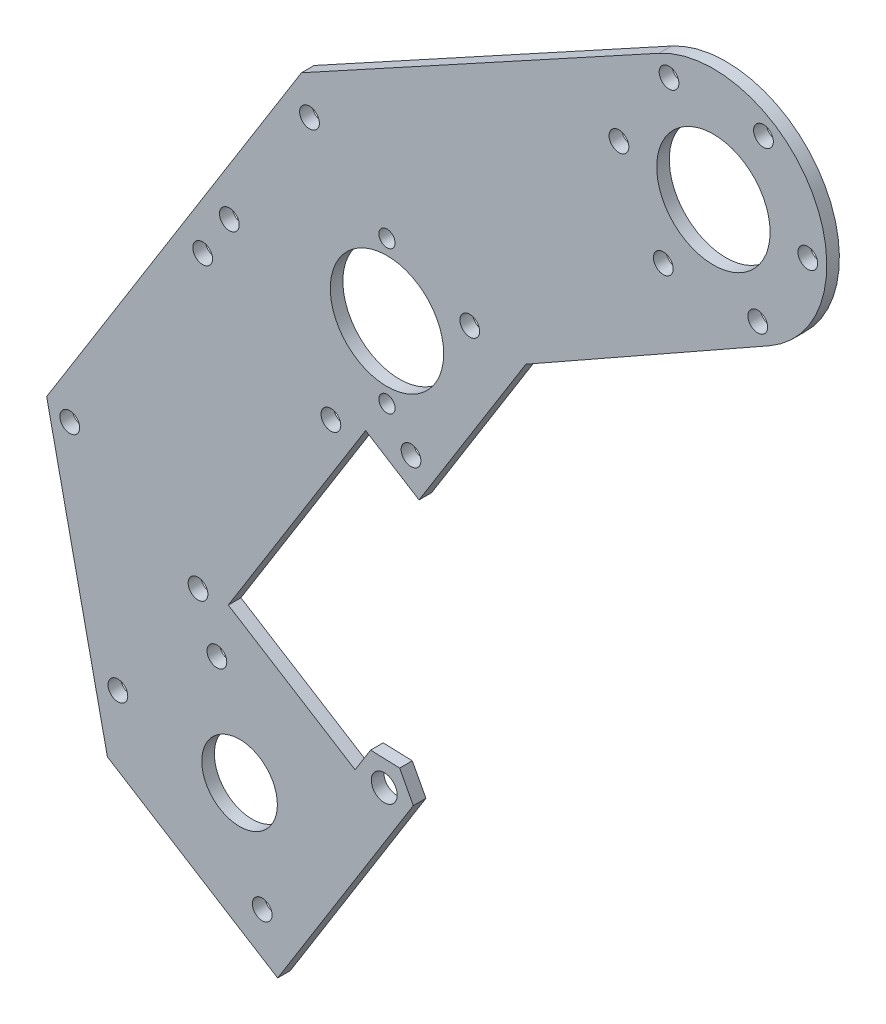
from build123d import *

# Parameters (mm, degrees)
SKETCH1_R                   = 14.2875
SKETCH1_R_2                 = 9.525
BOSS_EXTRUDE1_DEPTH         = 3.175
F_10_CLEARANCE_HOLE2_D      = 4.9784
F_10_CLEARANCE_HOLE3_D      = 4.9784
F_1_4_CLEARANCE_HOLE1_D     = 6.5278
F_20_0_161_DIAMETER_HOLE1_D = 4.0894


with BuildPart() as part:
    # Sketch1 → Boss-Extrude1 (new body)
    with BuildSketch(Plane.XY.offset(-14.194599474)):
        with BuildLine():
            Line((-11.403602879, 461.040918113), (18.881283072, 509.506866808))
            Line((18.881283072, 509.506866808), (22.784668372, 515.753589084))
            Line((22.784668372, 515.753589084), (19.342339301, 522.227668471))
            Line((19.342339301, 522.227668471), (12.014457551, 522.48356374))
            Line((12.014457551, 522.48356374), (8.11107225, 516.236841464))
            Line((8.11107225, 516.236841464), (-23.846467356, 536.206128526))
            Line((-23.846467356, 536.206128526), (10.759214603, 591.586796266))
            Line((10.759214603, 591.586796266), (24.22197813, 583.174327946))
            Line((24.22197813, 583.174327946), (51.141876753, 626.255171231))
            Line((51.141876753, 626.255171231), (112.462044501, 660.93728694))
            ThreePointArc((112.462044501, 660.93728694), (123.365099157, 699.702028842), (84.677956887, 710.877306848))
            Line((84.677956887, 710.877306848), (-5.401730059, 661.587538174))
            Line((-5.401730059, 661.587538174), (-69.615486106, 558.824047132))
            Line((-69.615486106, 558.824047132), (-54.307899735, 487.850498283))
            Line((-54.307899735, 487.850498283), (-11.403602879, 461.040918113))
        make_face()
        with Locations((16.14150623, 618.174698631)):
            Circle(SKETCH1_R, mode=Mode.SUBTRACT)
        with Locations((98.394472266, 685.809641802)):
            Circle(SKETCH1_R, mode=Mode.SUBTRACT)
        with Locations((-21.000382179, 498.8204658)):
            Circle(SKETCH1_R_2, mode=Mode.SUBTRACT)
    extrude(amount=BOSS_EXTRUDE1_DEPTH)

    # #10 Clearance Hole2 (through all)
    with Locations(Plane.XY.offset(-11.019599474)):
        with Locations((-26.71413896, 523.569465445), (-15.286625399, 474.071466154), (-3.381611976, 652.837445435), (37.006678604, 627.600040476), (22.201860047, 591.924420685), (-23.571535943, 620.526812972), (-31.474844299, 535.981130963), (-63.785476762, 556.17105493), (-51.664768266, 503.670498499), (2.009121865, 589.566678183), (-30.301510599, 609.756602151)):
            Hole(F_10_CLEARANCE_HOLE2_D / 2)

    # #10 Clearance Hole3 (through all)
    with Locations(Plane.XY.offset(-11.019599474)):
        with Locations((111.013174746, 706.003787092), (122.192466334, 684.978597537), (109.573763855, 664.784452247), (85.775769787, 665.615496512), (74.596478198, 686.640686067), (87.215180677, 706.834831357)):
            Hole(F_10_CLEARANCE_HOLE3_D / 2)

    # 1/4 Clearance Hole1 (through all)
    with Locations(Plane.XY.offset(-11.019599474)):
        with Locations((15.456786622, 516.009484354)):
            Hole(F_1_4_CLEARANCE_HOLE1_D / 2)

    # #20 (0.161) Diameter Hole1 (through all)
    with Locations(Plane.XY.offset(-11.019599474)):
        with Locations((16.141506225, 636.208698631), (16.141506234, 600.140698631)):
            Hole(F_20_0_161_DIAMETER_HOLE1_D / 2)


solid = part.part
